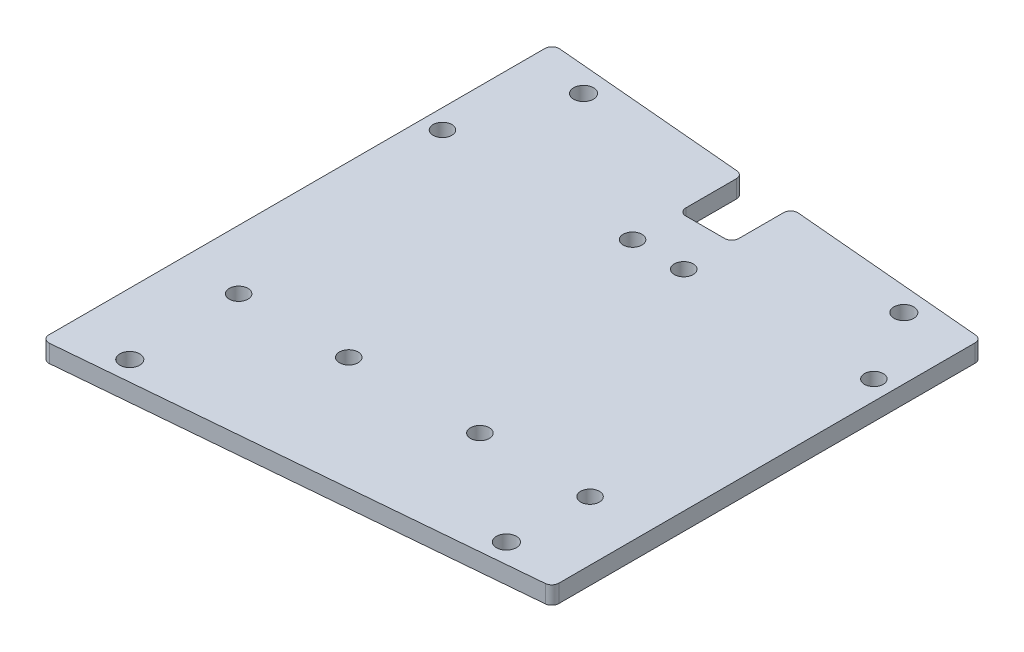
from build123d import *

# Parameters (mm, degrees)
BOSS_EXTRUDE1_DEPTH              = 6.35
SKETCH2_W                        = 19.05
SKETCH2_H                        = 44.45
CUT_EXTRUDE1_DEPTH               = 199.119607398
F_17_64_0_26563_DIAMETER_HOLE1_D = 6.747002
F_1_4_CLEARANCE_HOLE1_D          = 7.14248
SKETCH7_W                        = 3.175
SKETCH7_H                        = 184.33652634
SKETCH7_H_2                      = 154.225553014
CUT_EXTRUDE2_DEPTH               = 199.119607398
FILLET1_R                        = 2.54


with BuildPart() as part:
    # Sketch1 → Boss-Extrude1 (new body)
    with BuildSketch(Plane(origin=(0, 0, 0), x_dir=(1, 0, 0), z_dir=(0, 1, 0))):
        Polygon((0, -76.835), (0, 76.835), (-175.26, 92.16826317), (-175.26, -92.16826317), align=None)
    extrude(amount=BOSS_EXTRUDE1_DEPTH)

    # Sketch2 → Cut-Extrude1 (cut, through all)
    with BuildSketch(Plane(origin=(0, 6.35, 0), x_dir=(1, 0, 0), z_dir=(0, 1, 0))):
        with Locations((-87.63, 84.501631585)):
            Rectangle(SKETCH2_W, SKETCH2_H)
    extrude(amount=-CUT_EXTRUDE1_DEPTH, mode=Mode.SUBTRACT)

    # 17/64 (0.26563) Diameter Hole1 (through all)
    with Locations(Plane(origin=(0, 6.35, 0), x_dir=(1, 0, 0), z_dir=(0, 1, 0))):
        with Locations((-24.485, -42.27), (-64.0721, -42.27), (-111.1879, -42.27), (-150.775, -42.27), (-78.4321, 45.355), (-10.125, 45.355), (-96.8279, 45.355), (-165.135, 45.355)):
            Hole(F_17_64_0_26563_DIAMETER_HOLE1_D / 2)

    # 1/4 Clearance Hole1 (through all)
    with Locations(Plane(origin=(0, 6.35, 0), x_dir=(1, 0, 0), z_dir=(0, 1, 0))):
        with Locations((-25.4, 71.400370648), (-25.4, -71.400370648), (-149.86, -82.28920971), (-151.13, 82.042)):
            Hole(F_1_4_CLEARANCE_HOLE1_D / 2)

    # Sketch7 → Cut-Extrude2 (cut, through all)
    with BuildSketch(Plane(origin=(0, 6.35, 0), x_dir=(1, 0, 0), z_dir=(0, 1, 0))):
        with Locations((-173.6725, 0)):
            Rectangle(SKETCH7_W, SKETCH7_H)
        with Locations((-1.5875, 0)):
            Rectangle(SKETCH7_W, SKETCH7_H_2)
    extrude(amount=-CUT_EXTRUDE2_DEPTH, mode=Mode.SUBTRACT)

    # Fillet1
    fillet1_edges = [part.edges().sort_by_distance(p)[0] for p in [
        (-172.085, 3.175, -91.890486663),
        (-172.085, 3.175, 91.890486663),
        (-3.175, 3.175, 77.112776507),
        (-3.175, 3.175, -77.112776507),
        (-97.155, 3.175, -85.334961105),
        (-97.155, 3.175, -62.276631585),
        (-78.105, 3.175, -83.668302065),
        (-78.105, 3.175, -62.276631585),
    ]]
    fillet(fillet1_edges, radius=FILLET1_R)


solid = part.part
